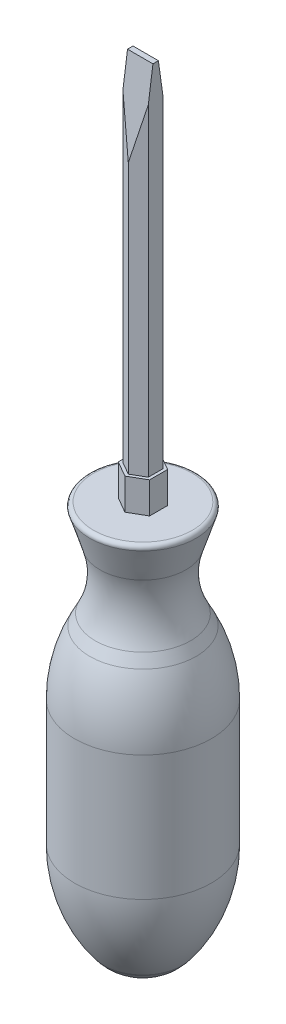
from build123d import *

# Parameters (mm, degrees)
AUFSATZ_LINEAR_AUSTRAGEN1_DEPTH      = 8
AUFSATZ_LINEAR_AUSTRAGEN2_DEPTH      = 91
SCHNITT_LINEAR_AUSTRAGEN1_DEPTH      = 105.959516136
SCHNITT_LINEAR_AUSTRAGEN1_DEPTH_BACK = 105.959516136


with BuildPart() as part:
    # Skizze1 → Rotation3 (revolve)
    with BuildSketch(Plane.XY, mode=Mode.PRIVATE) as rotation3_sk:
        with BuildLine():
            Line((-9.704368381, -98.133930518), (-9.932000587, -97.840841346))
            ThreePointArc((-9.932000587, -97.840841346), (-15.555484295, -87.430194788), (-17.5, -75.758691482))
            Line((-17.5, -75.758691482), (-17.5, -43.769743195))
            ThreePointArc((-17.5, -43.769743195), (-16.512197538, -35.394420898), (-13.60299869, -27.478718823))
            Line((-13.60299869, -27.478718823), (-12.198660374, -24.711337836))
            ThreePointArc((-12.198660374, -24.711337836), (-10.099873178, -17.28685515), (-10.967624651, -9.620378892))
            Line((-10.967624651, -9.620378892), (-13.60299869, -1.302019492))
            ThreePointArc((-13.60299869, -1.302019492), (-13.45654869, -0.409246029), (-12.649696941, 0))
            Line((-12.649696941, 0), (0, 0))
            Line((0, 0), (0, -102))
            Line((0, -102), (-1.80659044, -102))
            ThreePointArc((-1.80659044, -102), (-6.203219536, -100.981628616), (-9.704368381, -98.133930518))
        make_face()
    revolve(rotation3_sk.sketch.rotate(Axis((0, 79.626152289, 0), (0, -1, 0)), 270), axis=Axis((0, 79.626152289, 0), (0, -1, 0)))

    # Skizze2 → Aufsatz-Linear austragen1 (add)
    with BuildSketch(Plane(origin=(0, 0, 0), x_dir=(1, 0, 0), z_dir=(0, 1, 0))):
        Polygon((-4, -2.309401077), (0, -4.618802154), (4, -2.309401077), (4, 2.309401077), (0, 4.618802154), (-4, 2.309401077), align=None)
    extrude(amount=AUFSATZ_LINEAR_AUSTRAGEN1_DEPTH)

    # Skizze3 → Aufsatz-Linear austragen2 (add)
    with BuildSketch(Plane(origin=(0, 8, 0), x_dir=(1, 0, 0), z_dir=(0, 1, 0))):
        Polygon((-3.25, -1.876388375), (0, -3.75277675), (3.25, -1.876388375), (3.25, 1.876388375), (0, 3.75277675), (-3.25, 1.876388375), align=None)
    extrude(amount=AUFSATZ_LINEAR_AUSTRAGEN2_DEPTH)

    # Skizze4 → Schnitt-Linear austragen1 (cut, two sides: drawn at the far end of the back side and taken through both)
    with BuildSketch(Plane(origin=(0, 0, 0), x_dir=(0, 0, -1), z_dir=(1, 0, 0)).offset(-SCHNITT_LINEAR_AUSTRAGEN1_DEPTH_BACK)):
        Polygon((-0.7, 99), (-3.75277675, 77), (-3.75277675, 99), align=None)
        Polygon((0.7, 99), (3.75277675, 77), (3.75277675, 99), align=None)
    extrude(amount=SCHNITT_LINEAR_AUSTRAGEN1_DEPTH + SCHNITT_LINEAR_AUSTRAGEN1_DEPTH_BACK, mode=Mode.SUBTRACT)


solid = part.part
